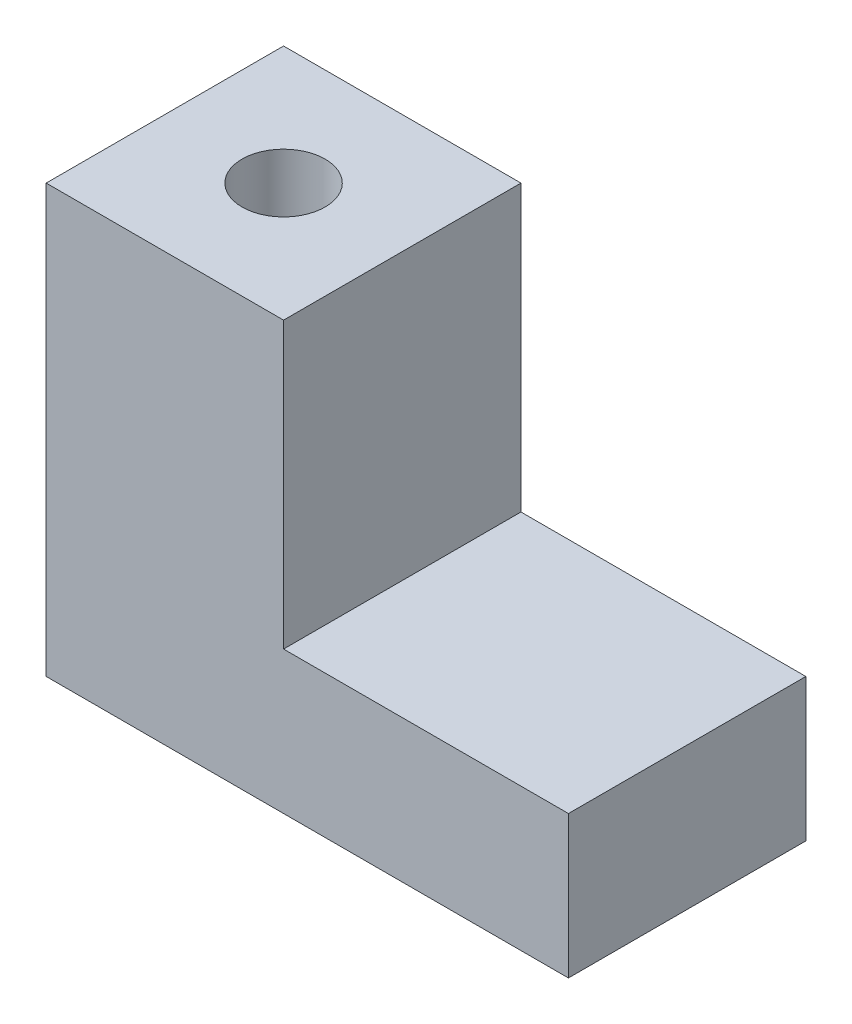
from build123d import *

# Parameters (mm, degrees)
SKETCH1_W           = 22
SKETCH1_H           = 10
BOSS_EXTRUDE1_DEPTH = 6
SKETCH2_W           = 10
SKETCH2_H           = 10
BOSS_EXTRUDE2_DEPTH = 12
SKETCH3_R           = 1.75
CUT_EXTRUDE1_DEPTH  = 31.133038347
CUT_EXTRUDE2_DEPTH  = 3


with BuildPart() as part:
    # Sketch1 → Boss-Extrude1 (new body)
    with BuildSketch(Plane(origin=(0, 0, 0), x_dir=(1, 0, 0), z_dir=(0, 1, 0))):
        with Locations((11, 5)):
            Rectangle(SKETCH1_W, SKETCH1_H)
    extrude(amount=BOSS_EXTRUDE1_DEPTH)

    # Sketch2 → Boss-Extrude2 (add)
    with BuildSketch(Plane(origin=(0, 6, 0), x_dir=(1, 0, 0), z_dir=(0, 1, 0))):
        with Locations((5, 5)):
            Rectangle(SKETCH2_W, SKETCH2_H)
    extrude(amount=BOSS_EXTRUDE2_DEPTH)

    # Sketch3 → Cut-Extrude1 (cut, through all)
    with BuildSketch(Plane(origin=(0, 18, 0), x_dir=(1, 0, 0), z_dir=(0, 1, 0))):
        with Locations(Location((5, 5, 0), (0, 0, 270))):
            Circle(SKETCH3_R)
    extrude(amount=-CUT_EXTRUDE1_DEPTH, mode=Mode.SUBTRACT)

    # Sketch4 → Cut-Extrude2 (cut)
    with BuildSketch(Plane.XZ):
        Polygon((1.824573519, -5), (3.41228676, -7.75), (6.58771324, -7.75), (8.175426481, -5), (6.58771324, -2.25), (3.41228676, -2.25), align=None)
    extrude(amount=-CUT_EXTRUDE2_DEPTH, mode=Mode.SUBTRACT)


solid = part.part
